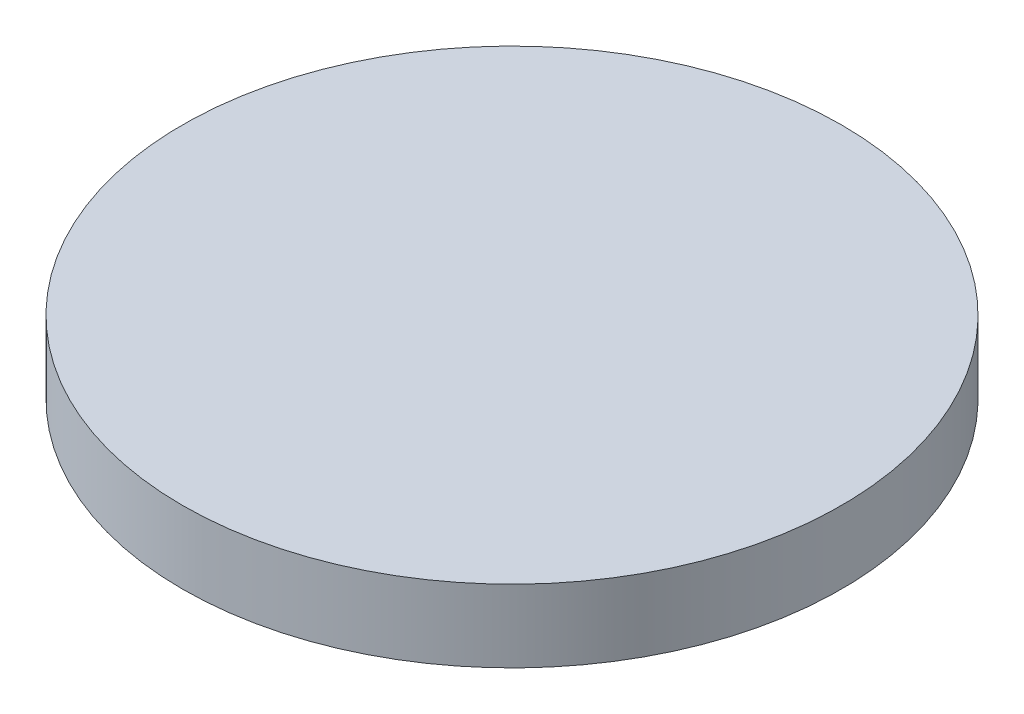
from build123d import *

# Parameters (mm, degrees)
SKETCH1_R           = 25
BOSS_EXTRUDE1_DEPTH = 5.5
SKETCH2_R           = 24
CUT_EXTRUDE1_DEPTH  = 3.5
SKETCH3_R           = 20.4
SKETCH3_R_2         = 19.9
CUT_EXTRUDE2_DEPTH  = 1


with BuildPart() as part:
    # Sketch1 → Boss-Extrude1 (new body)
    with BuildSketch(Plane(origin=(0, 0, 0), x_dir=(1, 0, 0), z_dir=(0, 1, 0))):
        with Locations(Location((0, 0, 0), (0, 0, 270))):
            Circle(SKETCH1_R)
    extrude(amount=BOSS_EXTRUDE1_DEPTH)

    # Sketch2 → Cut-Extrude1 (cut)
    with BuildSketch(Plane.XZ):
        with Locations(Location((0, 0, 0), (0, 0, 270))):
            Circle(SKETCH2_R)
    extrude(amount=-CUT_EXTRUDE1_DEPTH, mode=Mode.SUBTRACT)

    # Sketch3 → Cut-Extrude2 (cut)
    with BuildSketch(Plane(origin=(0, 3.5, 0), x_dir=(-1, 0, 0), z_dir=(0, -1, 0))):
        with Locations(Location((0, 0, 0), (0, 0, 90))):
            Circle(SKETCH3_R)
        with Locations(Location((0, 0, 0), (0, 0, 90))):
            Circle(SKETCH3_R_2, mode=Mode.SUBTRACT)
    extrude(amount=-CUT_EXTRUDE2_DEPTH, mode=Mode.SUBTRACT)


solid = part.part
